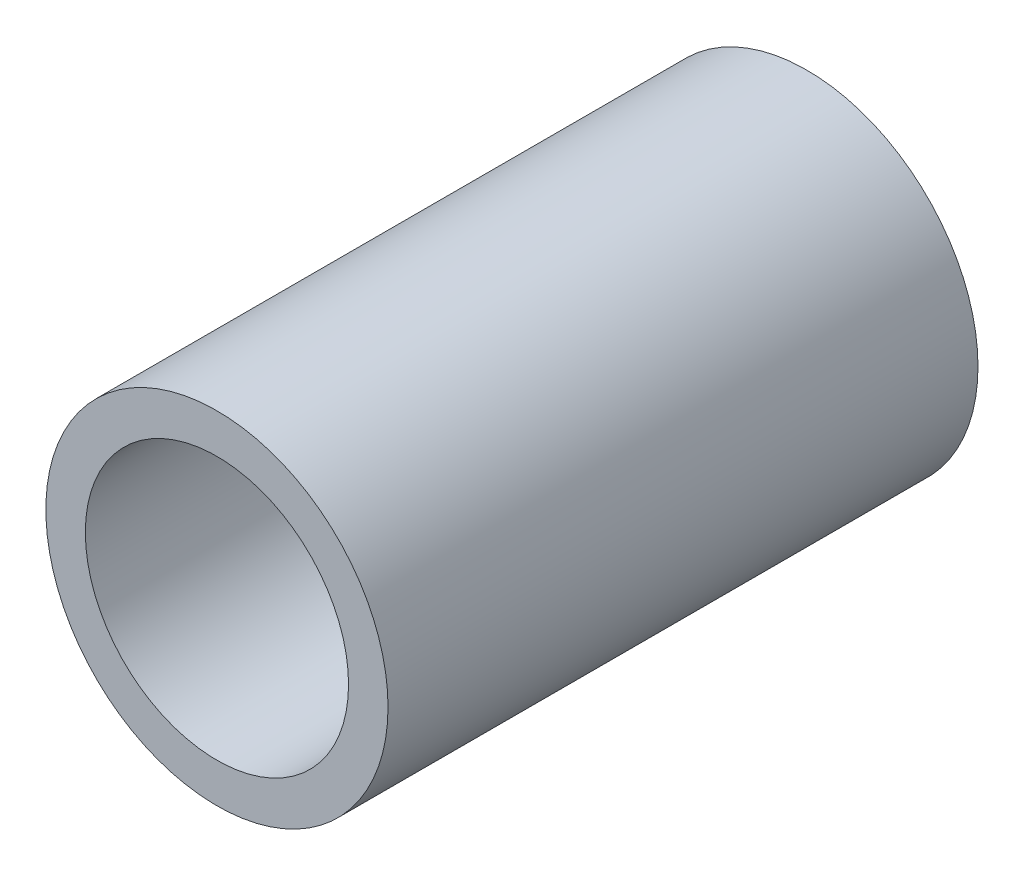
from build123d import *

# Parameters (mm, degrees)
SKETCH1_R           = 3.25
SKETCH1_R_2         = 2.5
BOSS_EXTRUDE1_DEPTH = 11.207


with BuildPart() as part:
    # Sketch1 → Boss-Extrude1 (new body)
    with BuildSketch(Plane.XY):
        Circle(SKETCH1_R)
        Circle(SKETCH1_R_2, mode=Mode.SUBTRACT)
    extrude(amount=BOSS_EXTRUDE1_DEPTH)


solid = part.part
